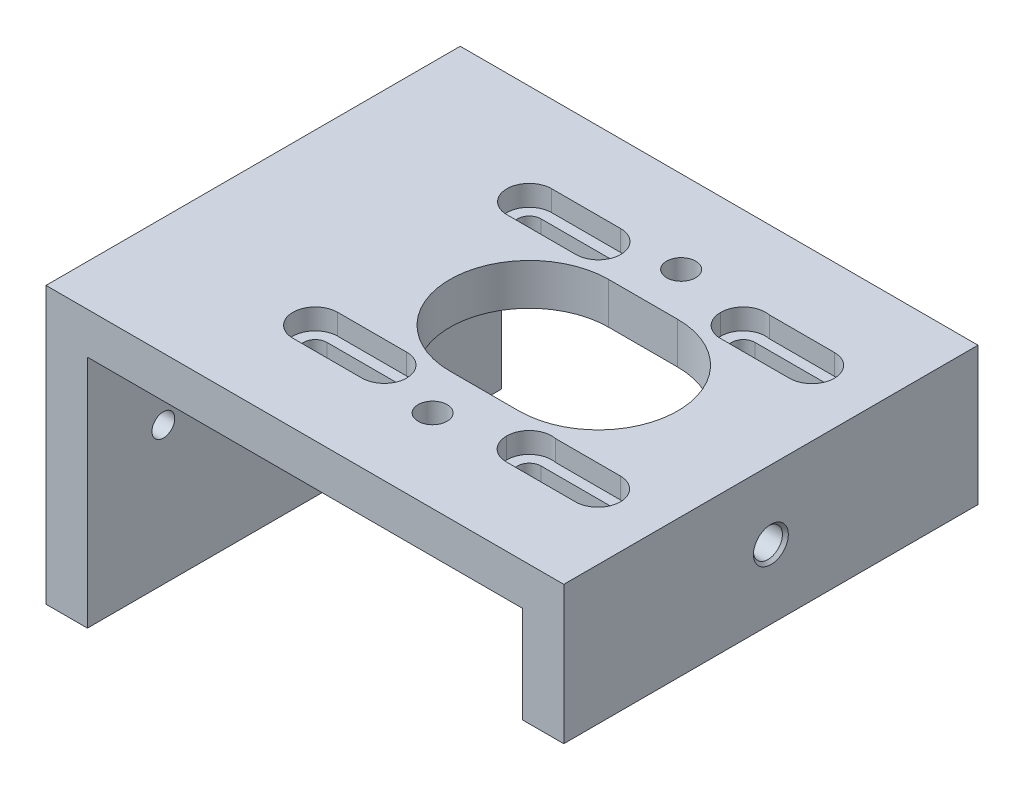
from build123d import *

# Parameters (mm, degrees)
BOSS_EXTRUDE1_DEPTH                                 = 60
CUT_EXTRUDE1_DEPTH                                  = 105.043260233
CBORE_FOR_M3_HEX_SOCKET_HEAD_CAP_SCREW1_D           = 3.4
CBORE_FOR_M3_HEX_SOCKET_HEAD_CAP_SCREW1_CBORE_D     = 6.5
CBORE_FOR_M3_HEX_SOCKET_HEAD_CAP_SCREW1_CBORE_DEPTH = 3
CUT_EXTRUDE5_REACH                                  = 106.043
CUT_EXTRUDE6_DEPTH                                  = 3
M5_TAPPED_HOLE1_D                                   = 4.2
M4_TAPPED_HOLE1_D                                   = 3.3
M4_TAPPED_HOLE1_DEPTH                               = 6
M4_TAPPED_HOLE1_CSINK_D                             = 4.5
M4_TAPPED_HOLE1_CSINK_ANGLE                         = 90
M5_TAPPED_HOLE2_D                                   = 4.2
M5_TAPPED_HOLE2_DEPTH                               = 6
M5_TAPPED_HOLE2_CSINK_D                             = 5.05
M5_TAPPED_HOLE2_CSINK_ANGLE                         = 90


with BuildPart() as part:
    # Sketch1 → Boss-Extrude1 (new body)
    with BuildSketch(Plane.XY):
        Polygon((0, 0), (6, 0), (6, 34), (69, 34), (69, 20), (75, 20), (75, 40), (0, 40), align=None)
    extrude(amount=BOSS_EXTRUDE1_DEPTH)

    # Sketch2 → Cut-Extrude1 (cut, through all)
    with BuildSketch(Plane(origin=(0, 40, 0), x_dir=(1, 0, 0), z_dir=(0, 1, 0))):
        with BuildLine():
            Line((40, -18.5), (50, -18.5))
            ThreePointArc((50, -18.5), (61.5, -30), (50, -41.5))
            Line((50, -41.5), (40, -41.5))
            ThreePointArc((40, -41.5), (28.5, -30), (40, -18.5))
        make_face()
    extrude(amount=-CUT_EXTRUDE1_DEPTH, mode=Mode.SUBTRACT)

    # CBORE for M3 Hex Socket Head Cap Screw1 (through all)
    with Locations(Plane(origin=(0, 40, 0), x_dir=(-1, 0, 0), z_dir=(0, 1, 0))):
        with Locations((-24.5, 45.5), (-55.5, 45.5), (-24.5, 14.5), (-55.5, 14.5)):
            CounterBoreHole(CBORE_FOR_M3_HEX_SOCKET_HEAD_CAP_SCREW1_D / 2, CBORE_FOR_M3_HEX_SOCKET_HEAD_CAP_SCREW1_CBORE_D / 2, CBORE_FOR_M3_HEX_SOCKET_HEAD_CAP_SCREW1_CBORE_DEPTH)

    # Sketch24 → Cut-Extrude5 (cut, up to next)
    with BuildSketch(Plane(origin=(0, 40, 0), x_dir=(1, 0, 0), z_dir=(0, 1, 0)), mode=Mode.PRIVATE) as cut_extrude5_sk1:
        with BuildLine():
            Line((24.5, -12.8), (34.5, -12.8))
            ThreePointArc((34.5, -12.8), (36.2, -14.5), (34.5, -16.2))
            Line((34.5, -16.2), (24.5, -16.2))
            ThreePointArc((24.5, -16.2), (22.8, -14.5), (24.5, -12.8))
        make_face()
    cut_extrude5_tool1 = extrude(cut_extrude5_sk1.sketch, amount=-CUT_EXTRUDE5_REACH, mode=Mode.PRIVATE) & part.part
    # Sketch24 → Cut-Extrude5 (cut, up to next)
    with BuildSketch(Plane(origin=(0, 40, 0), x_dir=(1, 0, 0), z_dir=(0, 1, 0)), mode=Mode.PRIVATE) as cut_extrude5_sk2:
        with BuildLine():
            Line((55.5, -12.8), (65.5, -12.8))
            ThreePointArc((65.5, -12.8), (67.2, -14.5), (65.5, -16.2))
            Line((65.5, -16.2), (55.5, -16.2))
            ThreePointArc((55.5, -16.2), (53.8, -14.5), (55.5, -12.8))
        make_face()
    cut_extrude5_tool2 = extrude(cut_extrude5_sk2.sketch, amount=-CUT_EXTRUDE5_REACH, mode=Mode.PRIVATE) & part.part
    # Sketch24 → Cut-Extrude5 (cut, up to next)
    with BuildSketch(Plane(origin=(0, 40, 0), x_dir=(1, 0, 0), z_dir=(0, 1, 0)), mode=Mode.PRIVATE) as cut_extrude5_sk3:
        with BuildLine():
            Line((24.5, -43.8), (34.5, -43.8))
            ThreePointArc((34.5, -43.8), (36.2, -45.5), (34.5, -47.2))
            Line((34.5, -47.2), (24.5, -47.2))
            ThreePointArc((24.5, -47.2), (22.8, -45.5), (24.5, -43.8))
        make_face()
    cut_extrude5_tool3 = extrude(cut_extrude5_sk3.sketch, amount=-CUT_EXTRUDE5_REACH, mode=Mode.PRIVATE) & part.part
    # Sketch24 → Cut-Extrude5 (cut, up to next)
    with BuildSketch(Plane(origin=(0, 40, 0), x_dir=(1, 0, 0), z_dir=(0, 1, 0)), mode=Mode.PRIVATE) as cut_extrude5_sk4:
        with BuildLine():
            Line((55.5, -43.8), (65.5, -43.8))
            ThreePointArc((65.5, -43.8), (67.2, -45.5), (65.5, -47.2))
            Line((65.5, -47.2), (55.5, -47.2))
            ThreePointArc((55.5, -47.2), (53.8, -45.5), (55.5, -43.8))
        make_face()
    cut_extrude5_tool4 = extrude(cut_extrude5_sk4.sketch, amount=-CUT_EXTRUDE5_REACH, mode=Mode.PRIVATE) & part.part
    add(cut_extrude5_tool1.solids().sort_by_distance((29.5, 40, 14.5))[0], mode=Mode.SUBTRACT)
    add(cut_extrude5_tool2.solids().sort_by_distance((60.5, 40, 14.5))[0], mode=Mode.SUBTRACT)
    add(cut_extrude5_tool3.solids().sort_by_distance((29.5, 40, 45.5))[0], mode=Mode.SUBTRACT)
    add(cut_extrude5_tool4.solids().sort_by_distance((60.5, 40, 45.5))[0], mode=Mode.SUBTRACT)

    # Sketch25 → Cut-Extrude6 (cut)
    with BuildSketch(Plane(origin=(0, 40, 0), x_dir=(1, 0, 0), z_dir=(0, 1, 0))):
        with BuildLine():
            Line((24.5, -11.25), (34.5, -11.25))
            ThreePointArc((34.5, -11.25), (37.75, -14.5), (34.5, -17.75))
            Line((34.5, -17.75), (24.5, -17.75))
            ThreePointArc((24.5, -17.75), (21.25, -14.5), (24.5, -11.25))
        make_face()
        with BuildLine():
            Line((55.499988687, -11.3096476), (65.499988687, -11.3096476))
            ThreePointArc((65.499988687, -11.3096476), (68.749988687, -14.5596476), (65.499988687, -17.8096476))
            Line((65.499988687, -17.8096476), (55.499988687, -17.8096476))
            ThreePointArc((55.499988687, -17.8096476), (52.249988687, -14.5596476), (55.499988687, -11.3096476))
        make_face()
        with BuildLine():
            Line((24.5, -42.25), (34.5, -42.25))
            ThreePointArc((34.5, -42.25), (37.75, -45.5), (34.5, -48.75))
            Line((34.5, -48.75), (24.5, -48.75))
            ThreePointArc((24.5, -48.75), (21.25, -45.5), (24.5, -42.25))
        make_face()
        with BuildLine():
            Line((55.499988687, -42.3096476), (65.499988687, -42.3096476))
            ThreePointArc((65.499988687, -42.3096476), (68.749988687, -45.5596476), (65.499988687, -48.8096476))
            Line((65.499988687, -48.8096476), (55.499988687, -48.8096476))
            ThreePointArc((55.499988687, -48.8096476), (52.249988687, -45.5596476), (55.499988687, -42.3096476))
        make_face()
    extrude(amount=-CUT_EXTRUDE6_DEPTH, mode=Mode.SUBTRACT)

    # M5 Tapped Hole1 (through all)
    with Locations(Plane(origin=(0, 40, 0), x_dir=(-1, 0, 0), z_dir=(0, 1, 0))):
        with Locations((-44, 12), (-44, 48)):
            Hole(M5_TAPPED_HOLE1_D / 2)

    # M4 Tapped Hole1
    with Locations(Plane.ZY):
        with Locations((11, 20), (49, 20)):
            CounterSinkHole(M4_TAPPED_HOLE1_D / 2, M4_TAPPED_HOLE1_CSINK_D / 2, depth=M4_TAPPED_HOLE1_DEPTH, counter_sink_angle=M4_TAPPED_HOLE1_CSINK_ANGLE)

    # M5 Tapped Hole2
    with Locations(Plane(origin=(75, 0, 0), x_dir=(0, 0, -1), z_dir=(1, 0, 0))):
        with Locations((-30, 30)):
            CounterSinkHole(M5_TAPPED_HOLE2_D / 2, M5_TAPPED_HOLE2_CSINK_D / 2, depth=M5_TAPPED_HOLE2_DEPTH, counter_sink_angle=M5_TAPPED_HOLE2_CSINK_ANGLE)


solid = part.part
